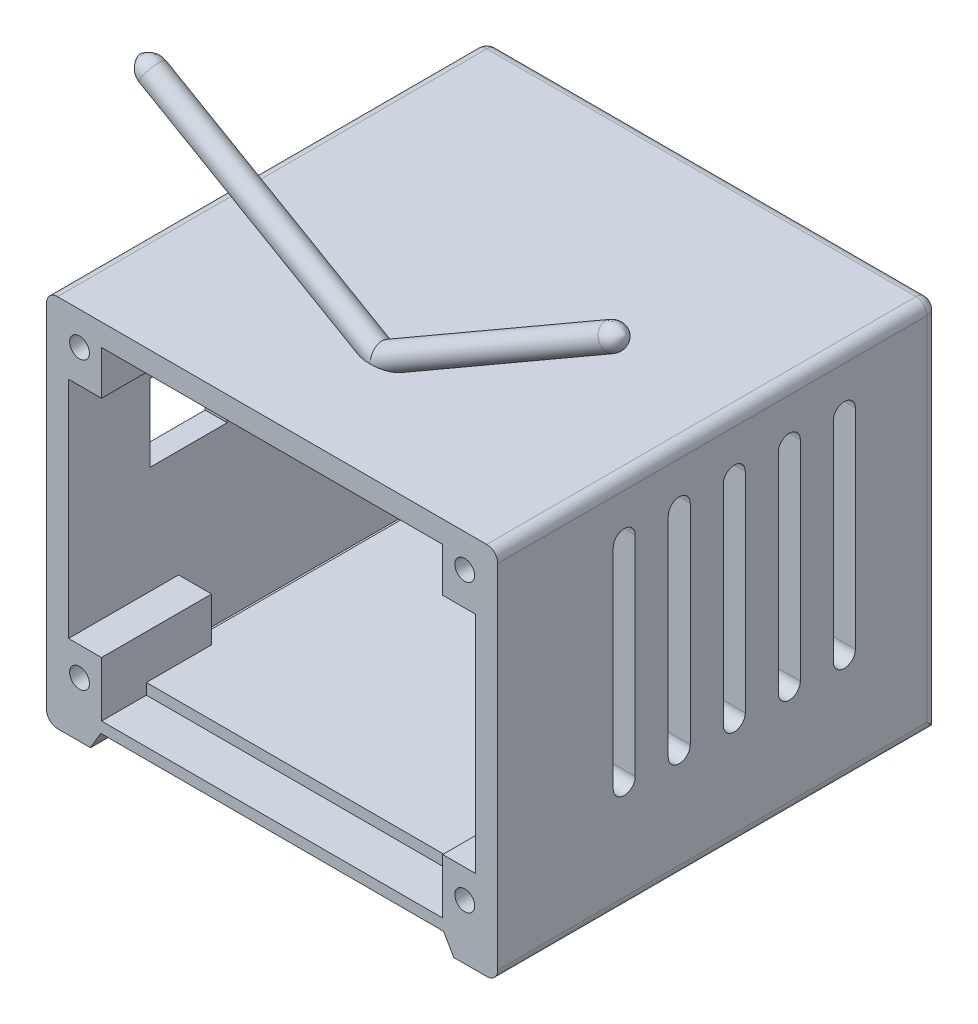
from build123d import *

# Parameters (mm, degrees)
EXTRUDE_1_DEPTH          = 40
SHELL_1_T                = -2
CUT_EXTRUDE_1_REACH      = 63.557
CUT_EXTRUDE_2_REACH      = 63.557
CUT_EXTRUDE_3_DEPTH      = 40
FILLET_1_R               = 1
EXTRUDE_3_DEPTH          = 10
CUT_EXTRUDE_6_DEPTH      = 2
CUT_EXTRUDE_6_DEPTH_BACK = 7
SKETCH_12_R              = 1.4999999999999987
SKETCH_14_R              = 2.5000000000000004
EXTRUDE_4_DEPTH          = 1
CUT_EXTRUDE_7_DEPTH      = 3
CUT_EXTRUDE_7_DEPTH_BACK = 1
SKETCH_12_3_R            = 1.4999999999999987
SKETCH_15_W              = 0.31410256410256565
SKETCH_15_H              = 2.5576923076923075
EXTRUDE_5_DEPTH          = 1
SKETCH_16_R              = 0.9000000000000002
SKETCH_16_R_2            = 0.9000000000000007
CUT_EXTRUDE_8_DEPTH      = 5
CUT_EXTRUDE_9_DEPTH      = 1


with BuildPart() as part:
    # 草图1 → 凸台-拉伸1 (new body)
    with BuildSketch(Plane.XY):
        Polygon((-19.615384615384617, 11.455384615384613), (21.384615384615383, 11.455384615384613), (21.3846153846154, -22.544615384615383), (17.38461538461538, -22.544615384615362), (16.46085495391198, -20.944615384615357), (-14.691624184681219, -20.94461538461539), (-15.615384615384615, -22.544615384615387), (-19.615384615384613, -22.544615384615387), align=None)
    extrude(amount=EXTRUDE_1_DEPTH)

    # 抽壳1
    shell_1_openings = [part.faces().sort_by_distance(p)[0] for p in [
        (0.884615385, -4.925099568, 40),
    ]]
    offset(amount=SHELL_1_T, openings=shell_1_openings, kind=Kind.INTERSECTION)

    # 草图2 → 切除-拉伸1 (cut, up to next)
    with BuildSketch(Plane(origin=(21.38461538461539, 1.091e-14, 0), x_dir=(0, 0, -1), z_dir=(1, 5.1e-16, 0)), mode=Mode.PRIVATE) as cut_extrude_1_sk1:
        with BuildLine():
            Line((-27.506729177901292, 6.455384615384603), (-27.506729177901285, -12.544615384615396))
            ThreePointArc((-27.506729177901285, -12.544615384615396), (-28.506729177901292, -13.5446153846154), (-29.506729177901295, -12.544615384615396))
            Line((-29.506729177901295, -12.544615384615396), (-29.506729177901292, 6.455384615384603))
            ThreePointArc((-29.506729177901292, 6.455384615384603), (-28.506729177901292, 7.455384615384603), (-27.506729177901292, 6.455384615384603))
        make_face()
    cut_extrude_1_tool1 = extrude(cut_extrude_1_sk1.sketch, amount=-CUT_EXTRUDE_1_REACH, mode=Mode.PRIVATE) & part.part
    # 草图2 → 切除-拉伸1 (cut, up to next)
    with BuildSketch(Plane(origin=(21.38461538461539, 1.091e-14, 0), x_dir=(0, 0, -1), z_dir=(1, 5.1e-16, 0)), mode=Mode.PRIVATE) as cut_extrude_1_sk2:
        with BuildLine():
            Line((-22.506729177901292, 6.4553846153846735), (-22.506729177901292, -12.544615384615327))
            ThreePointArc((-22.506729177901292, -12.544615384615327), (-23.506729177901295, -13.544615384615327), (-24.506729177901295, -12.544615384615327))
            Line((-24.506729177901295, -12.544615384615327), (-24.5067291779013, 6.4553846153846735))
            ThreePointArc((-24.5067291779013, 6.4553846153846735), (-23.506729177901295, 7.455384615384677), (-22.506729177901292, 6.4553846153846735))
        make_face()
    cut_extrude_1_tool2 = extrude(cut_extrude_1_sk2.sketch, amount=-CUT_EXTRUDE_1_REACH, mode=Mode.PRIVATE) & part.part
    # 草图2 → 切除-拉伸1 (cut, up to next)
    with BuildSketch(Plane(origin=(21.38461538461539, 1.091e-14, 0), x_dir=(0, 0, -1), z_dir=(1, 5.1e-16, 0)), mode=Mode.PRIVATE) as cut_extrude_1_sk3:
        with BuildLine():
            Line((-17.50672917790129, 6.455384615384743), (-17.50672917790129, -12.544615384615255))
            ThreePointArc((-17.50672917790129, -12.544615384615255), (-18.5067291779013, -13.544615384615259), (-19.506729177901303, -12.544615384615255))
            Line((-19.506729177901303, -12.544615384615255), (-19.5067291779013, 6.455384615384743))
            ThreePointArc((-19.5067291779013, 6.455384615384743), (-18.506729177901295, 7.45538461538475), (-17.50672917790129, 6.455384615384743))
        make_face()
    cut_extrude_1_tool3 = extrude(cut_extrude_1_sk3.sketch, amount=-CUT_EXTRUDE_1_REACH, mode=Mode.PRIVATE) & part.part
    # 草图2 → 切除-拉伸1 (cut, up to next)
    with BuildSketch(Plane(origin=(21.38461538461539, 1.091e-14, 0), x_dir=(0, 0, -1), z_dir=(1, 5.1e-16, 0)), mode=Mode.PRIVATE) as cut_extrude_1_sk4:
        with BuildLine():
            Line((-12.506729177901295, 6.455384615384813), (-12.506729177901295, -12.544615384615186))
            ThreePointArc((-12.506729177901295, -12.544615384615186), (-13.506729177901299, -13.544615384615186), (-14.506729177901299, -12.544615384615186))
            Line((-14.506729177901299, -12.544615384615186), (-14.506729177901294, 6.455384615384813))
            ThreePointArc((-14.506729177901294, 6.455384615384813), (-13.506729177901295, 7.455384615384813), (-12.506729177901295, 6.455384615384813))
        make_face()
    cut_extrude_1_tool4 = extrude(cut_extrude_1_sk4.sketch, amount=-CUT_EXTRUDE_1_REACH, mode=Mode.PRIVATE) & part.part
    # 草图2 → 切除-拉伸1 (cut, up to next)
    with BuildSketch(Plane(origin=(21.38461538461539, 1.091e-14, 0), x_dir=(0, 0, -1), z_dir=(1, 5.1e-16, 0)), mode=Mode.PRIVATE) as cut_extrude_1_sk5:
        with BuildLine():
            Line((-7.506729177901295, 6.455384615384882), (-7.506729177901297, -12.544615384615117))
            ThreePointArc((-7.506729177901297, -12.544615384615117), (-8.506729177901303, -13.544615384615117), (-9.506729177901303, -12.544615384615117))
            Line((-9.506729177901303, -12.544615384615117), (-9.506729177901295, 6.455384615384882))
            ThreePointArc((-9.506729177901295, 6.455384615384882), (-8.506729177901295, 7.455384615384883), (-7.506729177901295, 6.455384615384882))
        make_face()
    cut_extrude_1_tool5 = extrude(cut_extrude_1_sk5.sketch, amount=-CUT_EXTRUDE_1_REACH, mode=Mode.PRIVATE) & part.part
    add(cut_extrude_1_tool1.solids().sort_by_distance((21.384615, -3.044615, 28.506729))[0], mode=Mode.SUBTRACT)
    add(cut_extrude_1_tool2.solids().sort_by_distance((21.384615, -3.044615, 23.506729))[0], mode=Mode.SUBTRACT)
    add(cut_extrude_1_tool3.solids().sort_by_distance((21.384615, -3.044615, 18.506729))[0], mode=Mode.SUBTRACT)
    add(cut_extrude_1_tool4.solids().sort_by_distance((21.384615, -3.044615, 13.506729))[0], mode=Mode.SUBTRACT)
    add(cut_extrude_1_tool5.solids().sort_by_distance((21.384615, -3.044615, 8.506729))[0], mode=Mode.SUBTRACT)

    # 草图3 → 切除-拉伸2 (cut, up to next)
    with BuildSketch(Plane.ZY.offset(19.615384615384617), mode=Mode.PRIVATE) as cut_extrude_2_sk1:
        Polygon((32.58796768047955, 1.8231392903039718), (25.58796768047955, 1.8231392903039707), (25.58796768047955, -5.1768607096960295), (32.58796768047955, -5.1768607096960295), align=None)
    cut_extrude_2_tool1 = extrude(cut_extrude_2_sk1.sketch, amount=-CUT_EXTRUDE_2_REACH, mode=Mode.PRIVATE) & part.part
    add(cut_extrude_2_tool1.solids().sort_by_distance((-19.615385, -1.676861, 29.087968))[0], mode=Mode.SUBTRACT)

    # 草图4 → 切除-拉伸3 (cut)
    with BuildSketch(Plane(origin=(0, 0, 0), x_dir=(-1, 0, 0), z_dir=(0, 0, -1))):
        Polygon((4.6153846153846185, -17.365143113120048), (-7.3846153846153815, -17.365143113120048), (-7.384615384615383, -13.365143113120048), (4.6153846153846185, -13.365143113120048), align=None)
    extrude(amount=-CUT_EXTRUDE_3_DEPTH, mode=Mode.SUBTRACT)

    # 圆角1
    fillet_1_edges = [part.edges().sort_by_distance(p)[0] for p in [
        (0.8846153846153797, -20.944615384615375, 0),
        (-15.153504400032917, -21.744615384615386, 0),
        (-19.615384615384613, -5.544615384615387, 0),
        (-19.615384615384617, 11.455384615384613, 20),
        (21.384615384615383, 11.455384615384613, 20),
        (21.3846153846154, -22.544615384615383, 20),
        (-19.615384615384613, -22.544615384615387, 20),
        (0.8846153846153832, 11.455384615384613, 0),
        (21.384615384615394, -5.544615384615387, 0),
        (16.92273516926368, -21.744615384615358, 0),
    ]]
    fillet(fillet_1_edges, radius=FILLET_1_R)

    # 草图7 → 旋转2 (revolve)
    with BuildSketch(Plane.XY.offset(30), mode=Mode.PRIVATE) as revolve_2_sk:
        with BuildLine():
            Line((0.884615384615383, 12.734359475837627), (-19.416795673872034, 24.45538461538462))
            ThreePointArc((-19.416795673872034, 24.45538461538462), (-20.355916571022963, 24.640605022957534), (-21.212344473206116, 24.21307033757025))
            Line((-21.212344473206116, 24.21307033757025), (-0.22300933533856218, 12.094872045611147))
            Line((-0.22300933533856218, 12.094872045611147), (0.884615384615383, 11.455384615384613))
            Line((0.884615384615383, 11.455384615384613), (3.099864824523301, 11.45538461538461))
            Line((3.099864824523301, 11.45538461538461), (0.884615384615383, 12.734359475837627))
        make_face()
    revolve(revolve_2_sk.sketch.rotate(Axis((-21.212344473206116, 24.21307033757025, 30), (0.8660254037844387, -0.5000000000000001, 0)), 180), axis=Axis((-21.212344473206116, 24.21307033757025, 30), (0.8660254037844387, -0.5000000000000001, 0)))

    # 草图5 → 旋转3 (revolve)
    with BuildSketch(Plane.XY.offset(30), mode=Mode.PRIVATE) as revolve_3_sk:
        with BuildLine():
            Line((21.1860264431028, 24.45538461538462), (0.884615384615383, 12.73435947583762))
            Line((0.884615384615383, 12.73435947583762), (-0.2230093353385754, 12.094872045611117))
            Line((-0.2230093353385754, 12.094872045611117), (-1.330634055292535, 11.45538461538461))
            Line((-1.330634055292535, 11.45538461538461), (0.884615384615383, 11.455384615384613))
            Line((0.884615384615383, 11.455384615384613), (1.9922401045693376, 12.094872045611101))
            Line((1.9922401045693376, 12.094872045611101), (22.981575242436882, 24.213070337570244))
            ThreePointArc((22.981575242436882, 24.213070337570244), (22.12514734025373, 24.64060502295753), (21.1860264431028, 24.45538461538462))
        make_face()
    revolve(revolve_3_sk.sketch.rotate(Axis((1.9922401045693376, 12.094872045611101, 30), (0.8660254037844379, 0.5000000000000013, 0)), 180), axis=Axis((1.9922401045693376, 12.094872045611101, 30), (0.8660254037844379, 0.5000000000000013, 0)))

    # 草图8 → 凸台-拉伸3 (add)
    with BuildSketch(Plane.XY.offset(40)):
        Polygon((-14.615384615384617, 10.455384615384613), (-14.615384615384617, 5.455384615384614), (-19.615384615384617, 5.455384615384613), (-19.615384615384617, 10.455384615384613), (-17.93869022582513, 10.455384615384613), (-15.629289149066627, 10.455384615384613), align=None)
        Polygon((-19.615384615384617, -14.944615384615384), (-14.615384615384617, -14.944615384615384), (-14.615384615384617, -20.94461538461539), (-19.615384615384613, -20.94461538461539), align=None)
        Polygon((21.38461538461547, 10.455384615384574), (21.384615384615483, 5.455384615384618), (16.38461538461548, 5.4553846153846175), (16.38461538461548, 10.455384615384617), (17.39851991829749, 10.455384615384613), (19.707920995055993, 10.455384615384613), align=None)
        Polygon((21.384615384615408, -20.944615384615428), (21.384615384615486, -14.944615384615378), (16.384615384615483, -14.94461538461538), (16.384615384615486, -20.944615384615386), align=None)
    extrude(amount=-EXTRUDE_3_DEPTH)

    # 草图12 → 切除-拉伸6 (cut, two sides: drawn at the far end of the back side and taken through both)
    with BuildSketch(Plane(origin=(1.899e-14, -18.94461538461537, 0), x_dir=(1, 1e-15, 0), z_dir=(-1e-15, 1, 0)).offset(-CUT_EXTRUDE_6_DEPTH_BACK)):
        with Locations(Location((7.384615384615394, -4.000000000000001, 0), (0, 0, 180))):
            Circle(SKETCH_12_R)
    extrude(amount=CUT_EXTRUDE_6_DEPTH + CUT_EXTRUDE_6_DEPTH_BACK, mode=Mode.SUBTRACT)

    # 草图14 → 凸台-拉伸4 (add)
    with BuildSketch(Plane(origin=(1.899e-14, -18.94461538461537, 0), x_dir=(1, 1e-15, 0), z_dir=(-1e-15, 1, 0))):
        with Locations((7.384615384615394, -4)):
            Circle(SKETCH_14_R)
    extrude(amount=EXTRUDE_4_DEPTH)

    # 草图12<3> → 切除-拉伸7 (cut, two sides: drawn at the far end of the back side and taken through both)
    with BuildSketch(Plane(origin=(1.899e-14, -18.94461538461537, 0), x_dir=(1, 1e-15, 0), z_dir=(-1e-15, 1, 0)).offset(-CUT_EXTRUDE_7_DEPTH_BACK)):
        with Locations(Location((7.384615384615394, -4.000000000000001, 0), (0, 0, 180))):
            Circle(SKETCH_12_3_R)
    extrude(amount=CUT_EXTRUDE_7_DEPTH + CUT_EXTRUDE_7_DEPTH_BACK, mode=Mode.SUBTRACT)

    # 草图15 → 凸台-拉伸5 (add)
    # profile 1 of 10: a face of its own
    with BuildSketch(Plane(origin=(0, 0, 0), x_dir=(-1, 0, 0), z_dir=(0, 0, -1))):
        Polygon((-13.235435618454334, -2.4264448842055053), (-12.896793791531257, -2.4264448842055053), (-12.030908374864591, -4.3853791790773), (-11.151701644095361, -2.4264448842055053), (-10.81235869537741, -2.4264448842055053), (-12.382871515890232, -5.926444884205505), (-12.72221446460818, -5.926444884205505), (-12.201280971018436, -4.766088313692684), align=None)
    # profile 2 of 10: a face of its own
    with BuildSketch(Plane(origin=(0, 0, 0), x_dir=(-1, 0, 0), z_dir=(0, 0, -1))):
        with BuildLine():
            Line((-7.805948438967154, -2.4264448842055053), (-7.805948438967154, -4.984137191897813))
            Line((-7.805948438967154, -4.984137191897813), (-8.120051003069717, -4.984137191897813))
            Line((-8.120051003069717, -4.984137191897813), (-8.120051003069717, -4.541729339333711))
            add(Edge.make_bspline(
                [(-8.120051003069717, -4.541729339333711), (-8.155469793695879, -4.581768933291545), (-8.224590008976724, -4.659906704378485), (-8.3400311269482, -4.761988876869233), (-8.462399304850681, -4.84636719840929), (-8.591100625981381, -4.914517114109679), (-8.726018869326001, -4.965709170447037), (-8.866854956602255, -5.002095329572838), (-9.01366633746779, -5.025489164745088), (-9.113918692257794, -5.027825186614118), (-9.164722477428693, -5.029008986769608)],
                knots=[0, 0, 0, 0, 1.074387032113346, 2.0966798030584064, 3.0901592970760006, 4.057316772982397, 5.018401885804054, 5.98515953282395, 6.97896141729081, 8, 8, 8, 8], degree=3))
            add(Edge.make_bspline(
                [(-9.164722477428693, -5.029008986769608), (-9.209890431261229, -5.027782614500456), (-9.298963636149223, -5.025364154084823), (-9.429992713288136, -5.006601850466546), (-9.5560849627408, -4.97647122882447), (-9.677359535402589, -4.934570339332702), (-9.793031680836691, -4.8789895176945155), (-9.904091777509, -4.812448269653099), (-10.009964469528116, -4.7332074395724515), (-10.10903600849197, -4.6426194112195605), (-10.20026800886787, -4.54422442403595), (-10.280329281490056, -4.439278877160821), (-10.347082361344802, -4.328236573268153), (-10.402902442052078, -4.21250341937944), (-10.44589878649281, -4.091188499845408), (-10.475872420750727, -3.964711331905629), (-10.494612867451393, -3.833221458365781), (-10.497030328136344, -3.743681935270172), (-10.498256131274847, -3.6982798201029414)],
                knots=[0, 0, 0, 0, 1.0339198614522676, 2.0389357463115, 3.0240660249270315, 3.9988811309767454, 4.9706952598507455, 5.957263378189181, 6.959025759952125, 7.993208707104535, 9.027059324350772, 10.027763470871653, 11.009749336982424, 11.988697704588022, 12.965288444975128, 13.950418723590651, 14.960734634952502, 16, 16, 16, 16], degree=3))
            add(Edge.make_bspline(
                [(-10.498256131274847, -3.6982798201029414), (-10.497003159889964, -3.653816116533513), (-10.494526103054797, -3.565913773214179), (-10.47607288321453, -3.436635075228321), (-10.445041874555352, -3.3121168144950786), (-10.401494026889464, -3.1927598712713205), (-10.345652071926345, -3.07841982112273), (-10.277723984905489, -2.9690157961077923), (-10.197704860206654, -2.864246398645756), (-10.10545245319027, -2.766575171826981), (-10.00551768302763, -2.6763545575576013), (-9.89860895211226, -2.5979455121151354), (-9.787385670791428, -2.5302286632991144), (-9.670122660269046, -2.476575186992763), (-9.54855555545505, -2.4331660824483046), (-9.421602109707818, -2.4031331143477894), (-9.289790531032246, -2.385435793107782), (-9.200300038967631, -2.382873028956696), (-9.154906772300489, -2.3815730893337106)],
                knots=[0, 0, 0, 0, 1.0203925168901158, 2.0172609598320914, 2.9904654839553175, 3.961182958681917, 4.92805369863115, 5.906110375375646, 6.912531643907274, 7.94865271099346, 8.985773171673054, 9.998621851975404, 10.9876215878708, 11.96926133212434, 12.953316658238332, 13.946091881101239, 14.958173133256869, 16, 16, 16, 16], degree=3))
            add(Edge.make_bspline(
                [(-9.154906772300489, -2.3815730893337106), (-9.102706913237546, -2.3830108408755706), (-9.000345453257122, -2.3858302037925556), (-8.850617443990297, -2.409292931111536), (-8.708972966086742, -2.4489313982663816), (-8.574318614056665, -2.502848896289889), (-8.447137927961837, -2.5744976253718046), (-8.328634943645893, -2.664877586395442), (-8.217569460338083, -2.773418773365568), (-8.153189168678859, -2.856789217834797), (-8.120051003069717, -2.899702095743967)],
                knots=[0, 0, 0, 0, 1.0388971337659028, 2.037228247178309, 3.0081164335497066, 3.962042014540862, 4.918381754395657, 5.904844433346657, 6.921570400578856, 8, 8, 8, 8], degree=3))
            Line((-8.120051003069717, -2.899702095743967), (-8.120051003069717, -2.4264448842055053))
            Line((-8.120051003069717, -2.4264448842055053), (-7.805948438967154, -2.4264448842055053))
        make_face()
        with BuildLine():
            add(Edge.make_bspline(
                [(-9.150700041531257, -2.6956756534362745), (-9.196614379403313, -2.6973092911668264), (-9.287241979373212, -2.700533832205679), (-9.420285981435638, -2.725707327390246), (-9.547599395523676, -2.767591921754), (-9.668545469792242, -2.824873822922362), (-9.781213686414842, -2.8969025595394164), (-9.881907357244167, -2.9840239428312483), (-9.971450058600102, -3.0838609569859003), (-10.046758322832867, -3.195963067376079), (-10.10814881975255, -3.316141158444706), (-10.15131585168929, -3.44176559654578), (-10.179785099098446, -3.5705705741024647), (-10.182693619659915, -3.657933259880212), (-10.184153567172283, -3.7017854290773005)],
                knots=[0, 0, 0, 0, 1.031046208941199, 2.035121221496928, 3.0297061784224573, 4.034933723484602, 5.0340542524988665, 6.024430879729069, 7.0172957721224565, 8.038157696469613, 9.050218396665436, 10.039898859951926, 11.016116708505663, 12, 12, 12, 12], degree=3))
            add(Edge.make_bspline(
                [(-10.184153567172283, -3.7017854290773005), (-10.182288673862512, -3.745375536261301), (-10.178566196995003, -3.832384892128803), (-10.151815502597021, -3.9613654688971662), (-10.10693562916347, -4.087019510958487), (-10.045693566435428, -4.208280504478178), (-9.969006941706722, -4.320864604841867), (-9.880118289154492, -4.422604727403435), (-9.778168007841625, -4.510094315676241), (-9.665240500767542, -4.583331889281732), (-9.544632530367194, -4.642494410177168), (-9.417798598894336, -4.683660049684139), (-9.287122960737843, -4.710237830304314), (-9.198270626885913, -4.71334230714137), (-9.153504528710744, -4.7149064226670445)],
                knots=[0, 0, 0, 0, 0.9790721871862018, 1.954306742015218, 2.9458042713069506, 3.9696856698961316, 4.997920485315419, 5.99871843792759, 6.996577871940261, 8.005894224745894, 9.015743151514975, 10.005417472291388, 10.995077862527774, 12, 12, 12, 12], degree=3))
            add(Edge.make_bspline(
                [(-9.153504528710744, -4.7149064226670445), (-9.108058025948575, -4.7132464587412395), (-9.017669439427124, -4.709944955131264), (-8.88423073154711, -4.684663689838033), (-8.754735768749244, -4.642894891487973), (-8.630948540370891, -4.584995764753988), (-8.515632409223045, -4.513238408856912), (-8.412134531606602, -4.429231317826028), (-8.324618563233136, -4.331528133704024), (-8.250425953654908, -4.224151680659018), (-8.19225053695629, -4.10643968419815), (-8.149874477759226, -3.9811054934522367), (-8.12482057198291, -3.848144745307199), (-8.121662842340355, -3.7572808183485793), (-8.120051003069717, -3.710900012410634)],
                knots=[0, 0, 0, 0, 1.0176286604259368, 2.023962475198101, 3.030623092473401, 4.0588762735709425, 5.0772319367178715, 6.066672612691476, 7.0341078718686365, 8.005628643964329, 8.981990163666405, 9.965428785099354, 10.961468474412163, 12, 12, 12, 12], degree=3))
            add(Edge.make_bspline(
                [(-8.120051003069717, -3.710900012410634), (-8.121010659441307, -3.675562181902877), (-8.122899566870865, -3.6060061485489996), (-8.137330136401513, -3.5038786309769687), (-8.160285062813433, -3.406144904956649), (-8.192631232829907, -3.3127022158980495), (-8.235122517245463, -3.2240672004988067), (-8.286370283131863, -3.1396034402884907), (-8.347275732865452, -3.0597502288988103), (-8.416858428965424, -2.9856071579203385), (-8.493023631510889, -2.9179806956611163), (-8.57361817214297, -2.8576164549493543), (-8.659596919100402, -2.8080276822094974), (-8.749513956018152, -2.7669864107118554), (-8.843525290480203, -2.734327260814253), (-8.942395910298753, -2.712539567046185), (-9.045074897225808, -2.6975792460107866), (-9.115120952622123, -2.696316865241481), (-9.150700041531257, -2.6956756534362745)],
                knots=[0, 0, 0, 0, 1.0501407948110415, 2.0670094089140636, 3.0594989297950232, 4.030605086098515, 5.000119590184805, 5.9759109404031765, 6.962425594464801, 7.979863590506388, 8.99352347194609, 9.986985068986487, 10.967611495443121, 11.937549036896854, 12.921786183164564, 13.919465290515022, 14.943216302638504, 16, 16, 16, 16], degree=3))
        make_face(mode=Mode.SUBTRACT)
    # profile 3 of 10: a face of its own
    with BuildSketch(Plane(origin=(0, 0, 0), x_dir=(-1, 0, 0), z_dir=(0, 0, -1))):
        with BuildLine():
            Line((-7.087999721018436, -2.4264448842055053), (-6.773897156915872, -2.4264448842055053))
            Line((-6.773897156915872, -2.4264448842055053), (-6.773897156915872, -2.8877830252311463))
            add(Edge.make_bspline(
                [(-6.773897156915872, -2.8877830252311463), (-6.740359521783757, -2.845940302393521), (-6.675278570737192, -2.76474303890362), (-6.56689423746178, -2.6580224643435364), (-6.452350337139167, -2.570077239298755), (-6.332348333652007, -2.499973445354434), (-6.206725323552079, -2.447126819205771), (-6.076247053588984, -2.4089608881201), (-5.940132347501182, -2.3860760595804797), (-5.847567910627642, -2.3830858292809554), (-5.800740105633821, -2.3815730893337106)],
                knots=[0, 0, 0, 0, 1.1278077301501674, 2.1885502477053578, 3.191906510434029, 4.1594382511394565, 5.104880172197961, 6.052711205924762, 7.014878035284857, 8, 8, 8, 8], degree=3))
            add(Edge.make_bspline(
                [(-5.800740105633821, -2.3815730893337106), (-5.753409471517272, -2.3833182847749055), (-5.660772003753461, -2.3867340532183854), (-5.525893942371404, -2.413750744329432), (-5.399920548684625, -2.4598959994540848), (-5.283300992896536, -2.5231080698571318), (-5.1781737795338945, -2.6017145432609348), (-5.085848928057726, -2.6932923250200895), (-5.009485680680142, -2.7986284082556994), (-4.95828831768043, -2.8963515644923), (-4.924562669989443, -2.9830403587650967), (-4.903330332475621, -3.0572871088639455), (-4.885299351016248, -3.1400052600330204), (-4.86966760299855, -3.230944849087416), (-4.859090491131115, -3.330743039339775), (-4.850748199599836, -3.4389907313926975), (-4.844769505311535, -3.555652861888278), (-4.844532298324787, -3.63633948929816), (-4.844409977428692, -3.6779472880516595)],
                knots=[0, 0, 0, 0, 1.235846777863659, 2.418850247462125, 3.5758077408063955, 4.728682307181917, 5.871620073916632, 6.994088407782181, 8.112697850292307, 9.256955736378849, 9.86581671514485, 10.540099791640463, 11.271859617830467, 12.0768498384824, 12.949306005097048, 13.892391287565136, 14.9131661345487, 15.999999999999998, 15.999999999999998, 15.999999999999998, 15.999999999999998], degree=3))
            Line((-4.844409977428692, -3.6779472880516595), (-4.844409977428692, -4.984137191897813))
            Line((-4.844409977428692, -4.984137191897813), (-5.158512541531256, -4.984137191897813))
            Line((-5.158512541531256, -4.984137191897813), (-5.158512541531256, -3.781012191897813))
            add(Edge.make_bspline(
                [(-5.158512541531256, -3.781012191897813), (-5.158705749550203, -3.746189746969055), (-5.15907532360869, -3.679580336195088), (-5.16024097029323, -3.5842113130047464), (-5.163050776896193, -3.4977247346019666), (-5.166999089812236, -3.420327367196544), (-5.17277812034149, -3.352093530633195), (-5.1788007516914885, -3.2928842538946914), (-5.186165728488431, -3.242774711461877), (-5.192728641625594, -3.212609629078747), (-5.195671996659462, -3.1990811021542234)],
                knots=[0, 0, 0, 0, 1.430800155289277, 2.736877191538394, 3.918605306947136, 4.986035425796514, 5.920637408686338, 6.731861384559884, 7.43126137747252, 8, 8, 8, 8], degree=3))
            add(Edge.make_bspline(
                [(-5.195671996659462, -3.1990811021542234), (-5.206297528165786, -3.1593699172065746), (-5.226748388840487, -3.0829381725820033), (-5.277282371965628, -2.9792638199605563), (-5.341096552752997, -2.8910656321312573), (-5.418994402118166, -2.8188889105068653), (-5.510223477758536, -2.7627180738018553), (-5.614530620526371, -2.7237441190747966), (-5.7309092611986925, -2.699367849875889), (-5.812763643872175, -2.6969407178605627), (-5.855427605633821, -2.6956756534362745)],
                knots=[0, 0, 0, 0, 1.0841562269648397, 2.0866653055494275, 3.027808232996021, 3.945421171797415, 4.874247719431505, 5.8398483028531665, 6.87409047144053, 7.999999999999999, 7.999999999999999, 7.999999999999999, 7.999999999999999], degree=3))
            add(Edge.make_bspline(
                [(-5.855427605633821, -2.6956756534362745), (-5.88069528923869, -2.6961516580998146), (-5.930699382240452, -2.697093659030218), (-6.0048493541466, -2.706544957053207), (-6.076773527324559, -2.7220034126515658), (-6.147193736319338, -2.742872050150713), (-6.214701530054379, -2.771534319373402), (-6.281465821234562, -2.8040636895983075), (-6.344972585364391, -2.8446119015836384), (-6.40657598249287, -2.8898025230233984), (-6.463888790146041, -2.939881730220988), (-6.517217128556697, -2.9927262403738766), (-6.564755148807799, -3.049001844169962), (-6.607823824091489, -3.107801791699036), (-6.645002087469065, -3.1699336296961356), (-6.677455175531377, -3.2347979361749397), (-6.704990870323113, -3.3024800849988045), (-6.71867356279296, -3.3494551462295616), (-6.725519753069718, -3.3729593072824287)],
                knots=[0, 0, 0, 0, 1.0237777570634656, 2.0260297294316345, 3.023749951703791, 4.003683103366368, 4.997618607397139, 5.993177895327016, 7.010360494051259, 8.046726601717923, 9.087585522244343, 10.092341339987039, 11.086953742807342, 12.07036054899726, 13.043493632276721, 14.017870807697452, 15.008233676703249, 16, 16, 16, 16], degree=3))
            add(Edge.make_bspline(
                [(-6.725519753069718, -3.3729593072824287), (-6.729459401645408, -3.390214510336322), (-6.738035810506367, -3.4277781847417534), (-6.747298990365227, -3.489422604126334), (-6.755706565766903, -3.560732579118492), (-6.762743524385476, -3.6416248961743296), (-6.7670489408560535, -3.732382771291873), (-6.771743337629707, -3.832618609095864), (-6.773452398696094, -3.942732097451947), (-6.77374475271364, -4.019393790176713), (-6.773897156915872, -4.059357544461916)],
                knots=[0, 0, 0, 0, 0.6159636377364609, 1.3409206174653838, 2.168419149073875, 3.115676020576591, 4.166742419724606, 5.331190068864586, 6.60874890012252, 8, 8, 8, 8], degree=3))
            Line((-6.773897156915872, -4.059357544461916), (-6.773897156915872, -4.984137191897813))
            Line((-6.773897156915872, -4.984137191897813), (-7.087999721018436, -4.984137191897813))
            Line((-7.087999721018436, -4.984137191897813), (-7.087999721018436, -2.4264448842055053))
        make_face()
    # profile 4 of 10: a face of its own
    with BuildSketch(Plane(origin=(0, 0, 0), x_dir=(-1, 0, 0), z_dir=(0, 0, -1))):
        with BuildLine():
            Line((-1.8828715158902312, -2.4264448842055053), (-1.568768951787666, -2.4264448842055053))
            Line((-1.568768951787666, -2.4264448842055053), (-1.568768951787666, -4.456192480359352))
            add(Edge.make_bspline(
                [(-1.568768951787666, -4.456192480359352), (-1.5690459943585582, -4.499430074966175), (-1.5695807532546657, -4.58288904767143), (-1.5734317245093088, -4.703567327284336), (-1.581552401729688, -4.815033412816229), (-1.5907610830832373, -4.917795671405454), (-1.604007799402787, -5.011377781465432), (-1.6201841666411683, -5.0960589861394165), (-1.6384198457932613, -5.171920548507031), (-1.654440063247575, -5.21864538953456), (-1.6620181505056162, -5.24074776882089)],
                knots=[0, 0, 0, 0, 1.3075620387980986, 2.5239097017033645, 3.650326591493328, 4.686913196598194, 5.64342948645402, 6.506965703859498, 7.293745905280799, 8, 8, 8, 8], degree=3))
            add(Edge.make_bspline(
                [(-1.6620181505056162, -5.24074776882089), (-1.6732073892421424, -5.2694776904122795), (-1.6952513156858415, -5.326078527449244), (-1.7365369491447793, -5.406312848242904), (-1.7827708527635944, -5.481859238089155), (-1.8355776033988707, -5.55229668939379), (-1.894718407430644, -5.617271601756241), (-1.9587998995851588, -5.678195601035965), (-2.029070091006686, -5.733779768421211), (-2.1054888032126584, -5.7830650658780245), (-2.1862944364135792, -5.827452120031471), (-2.271440538480255, -5.865898687215075), (-2.36044697684393, -5.89938553083775), (-2.4541498684428573, -5.9244683265674905), (-2.5510801029109063, -5.946203047134418), (-2.652377533991344, -5.960347732928743), (-2.757450330796546, -5.969974791055728), (-2.828895710876923, -5.9708650240349135), (-2.8651431505056153, -5.9713166790773)],
                knots=[0, 0, 0, 0, 0.981931300775359, 1.934503488284449, 2.8707786400004536, 3.8017069990365107, 4.735015491989949, 5.66749162913369, 6.61659306551481, 7.585388520850982, 8.561939025284293, 9.551802639395596, 10.560317336748897, 11.58843994375192, 12.640189603608606, 13.723962949351153, 14.845264515448761, 15.999999999999998, 15.999999999999998, 15.999999999999998, 15.999999999999998], degree=3))
            add(Edge.make_bspline(
                [(-2.8651431505056153, -5.9713166790773), (-2.918027885107367, -5.970460193266641), (-3.0213259803374117, -5.968787246366198), (-3.171930973022059, -5.949296331274811), (-3.3149656929481184, -5.921741958201443), (-3.4485401496481694, -5.880036530569102), (-3.5718102465188086, -5.8289995408380895), (-3.6839341220489614, -5.770404587883629), (-3.7839052295667703, -5.703215279082245), (-3.8740289025698447, -5.626714678165766), (-3.9553704927059035, -5.535750996528387), (-4.03189778268643, -5.4285521524036335), (-4.105558724544379, -5.303485263252451), (-4.148727362412117, -5.211692550037959), (-4.171333054351769, -5.1636243713849925)],
                knots=[0, 0, 0, 0, 1.1578970852294168, 2.2616840999076997, 3.322078979505765, 4.345638746057099, 5.321241054785491, 6.241986251983472, 7.112515962828019, 7.955008012233809, 8.825025602432447, 9.778571639992997, 10.836726668879825, 12, 12, 12, 12], degree=3))
            Line((-4.171333054351769, -5.1636243713849925), (-3.8572304902492056, -5.1636243713849925))
            add(Edge.make_bspline(
                [(-3.8572304902492056, -5.1636243713849925), (-3.8319682809437823, -5.203730247157399), (-3.7825837725399984, -5.282132295655128), (-3.6902352915731726, -5.383645451589948), (-3.5890289652257574, -5.470398816277393), (-3.4755492820413068, -5.5403095903421065), (-3.349324066633263, -5.593019381743825), (-3.210277380463721, -5.630594678179804), (-3.057277758728826, -5.653090945036156), (-2.950759544545779, -5.655802239176527), (-2.895291387685102, -5.657214114974736)],
                knots=[0, 0, 0, 0, 0.9977318936184523, 1.9504429913240786, 2.8804922725155517, 3.8008959972672502, 4.748200782495247, 5.754801363074869, 6.830838170434118, 8, 8, 8, 8], degree=3))
            add(Edge.make_bspline(
                [(-2.895291387685102, -5.657214114974736), (-2.840524497341206, -5.655783966179675), (-2.7349394146880828, -5.653026782454537), (-2.583108245642724, -5.630584638281861), (-2.444513307574805, -5.593011204520142), (-2.3199531069477866, -5.540402818273996), (-2.210897338410455, -5.47595241173936), (-2.116885347125907, -5.403952337329566), (-2.040740670983281, -5.3227713343149885), (-1.9895277043134556, -5.247989528224263), (-1.957693086714625, -5.181365398527337), (-1.9374208499489955, -5.124012802569758), (-1.9209468804946654, -5.059159924907329), (-1.9071670429590104, -4.987024188684764), (-1.895796129587429, -4.907502531617587), (-1.888593247239973, -4.820413128242737), (-1.8833874356677014, -4.72595390592085), (-1.883047465819054, -4.660460767711191), (-1.8828715158902312, -4.626565076513198)],
                knots=[0, 0, 0, 0, 1.5707407652431116, 3.028230971001376, 4.391408896288629, 5.680370740507808, 6.89472739268695, 8.017376726172056, 9.065722032601572, 10.075533814852792, 10.603371121805758, 11.180248986105822, 11.817768598223395, 12.5212996492551, 13.286540595986038, 14.121245857124437, 15.027658896722862, 16, 16, 16, 16], degree=3))
            Line((-1.8828715158902312, -4.626565076513198), (-1.8828715158902312, -4.494053057282429))
            add(Edge.make_bspline(
                [(-1.8828715158902312, -4.494053057282429), (-1.9147526332927356, -4.5319948594395845), (-1.9779540890167069, -4.607211079086103), (-2.087101416149597, -4.705772715779219), (-2.2063183317794985, -4.790658846080607), (-2.335401874181806, -4.860277480593748), (-2.4711901163405674, -4.915958905203036), (-2.6122123467579654, -4.954901866105828), (-2.757204401959116, -4.980061765996175), (-2.855456551783801, -4.982769082232104), (-2.905107092813308, -4.984137191897813)],
                knots=[0, 0, 0, 0, 1.012485704116201, 2.0071620951035833, 2.997754122520352, 3.998611388747787, 4.999708251462927, 5.992315797909911, 6.985440959530821, 8, 8, 8, 8], degree=3))
            add(Edge.make_bspline(
                [(-2.905107092813308, -4.984137191897813), (-2.934343362234834, -4.983622165427354), (-2.992469919790732, -4.982598207296913), (-3.078824667023015, -4.973639429871798), (-3.163905105351408, -4.960640687577591), (-3.247512808978367, -4.941559248593861), (-3.329768422045287, -4.917067522055073), (-3.4105360141666288, -4.886450783305573), (-3.4904695407334216, -4.851835665038858), (-3.568116038595144, -4.811062861599921), (-3.642702169329583, -4.765700554739934), (-3.7136653544648883, -4.716561664029821), (-3.7806338935523858, -4.663903375788413), (-3.8429703830019206, -4.607206435992261), (-3.900593054450838, -4.5465529032299425), (-3.9542769225055414, -4.482589350197334), (-4.003134269572521, -4.41442260885183), (-4.048167658813042, -4.3432956513186625), (-4.087225209186181, -4.268734727507122), (-4.121509581011424, -4.192356632079385), (-4.151318986052179, -4.114324677594005), (-4.175084387788719, -4.034377614939489), (-4.193235501058467, -3.952565846073284), (-4.206745728047511, -3.869023397201409), (-4.2144086597032775, -3.7834930095713553), (-4.215603583747574, -3.7258716603766713), (-4.216204849223564, -3.696877576513198)],
                knots=[0, 0, 0, 0, 1.0287542167485988, 2.0453341816135553, 3.0528548194496876, 4.056607502606393, 5.0611687943930255, 6.071104265450905, 7.095078842401183, 8.125279047134654, 9.155117945212487, 10.16595749143834, 11.161587969490807, 12.151493252204713, 13.128948131078733, 14.104219989436098, 15.088194871141429, 16.07871515046623, 17.064853786945807, 18.04789988724517, 19.024142579604103, 20.002704429250606, 20.9805745690138, 21.971845992707184, 22.979467364139524, 24, 24, 24, 24], degree=3))
            add(Edge.make_bspline(
                [(-4.216204849223564, -3.696877576513198), (-4.215685682948023, -3.66787448051408), (-4.214649361203266, -3.6099806217154966), (-4.205698381851857, -3.524101236328032), (-4.192930192427781, -3.439371801086143), (-4.172722423431889, -3.3566656593940936), (-4.148399900921005, -3.275040907630725), (-4.118276328363732, -3.195100451219237), (-4.082057569026794, -3.116819942112027), (-4.041047819350383, -3.040141410666611), (-3.9949637266988693, -2.9660937957321565), (-3.944431245891814, -2.895767149827478), (-3.889389371632035, -2.8296789779015934), (-3.830597456011776, -2.7671625560332087), (-3.7673376389734696, -2.708821062816731), (-3.6996426466281966, -2.654796097933238), (-3.628179766381902, -2.6041820716637156), (-3.55272751638599, -2.5580707345026816), (-3.474450127869279, -2.517288487982722), (-3.3953363100763982, -2.480075891058052), (-3.3143380750556184, -2.45054177152792), (-3.2329655356316707, -2.4245186724924292), (-3.1497856208686685, -2.40608347727258), (-3.065818227246206, -2.3918612353548245), (-2.980775889490937, -2.3831965143295326), (-2.923822994443381, -2.3821149293468578), (-2.895291387685102, -2.3815730893337106)],
                knots=[0, 0, 0, 0, 1.0088188479322986, 2.013730394069599, 3.0016544267669807, 3.987803272875369, 4.97304654889751, 5.96377756935008, 6.957074693587044, 7.972068340898089, 8.98742021169413, 9.989399530949012, 10.98263008700414, 11.97775609121338, 12.973280677282746, 13.973972380688602, 14.98919400302398, 16.01838722210486, 17.047741039332788, 18.059210845676787, 19.057554164251336, 20.045176975080302, 21.02948026139245, 22.01870852894763, 23.00743537131176, 23.999999999999996, 23.999999999999996, 23.999999999999996, 23.999999999999996], degree=3))
            add(Edge.make_bspline(
                [(-2.895291387685102, -2.3815730893337106), (-2.8482404487056394, -2.3829297626158494), (-2.755329301385313, -2.3856087754882047), (-2.618598298956831, -2.406629920871406), (-2.486656058979871, -2.440143934223054), (-2.3587580433028985, -2.488159564733235), (-2.2338623923016363, -2.5537096030682642), (-2.112380736991617, -2.640052551078545), (-1.9939616028166982, -2.747962890810509), (-1.9208837722690122, -2.8307157551777187), (-1.8828715158902312, -2.8737605893337106)],
                knots=[0, 0, 0, 0, 0.9672886299896992, 1.9100978291098045, 2.838038872678902, 3.7628751956017426, 4.713152790342971, 5.7306312386907585, 6.819562286860808, 8, 8, 8, 8], degree=3))
            Line((-1.8828715158902312, -2.8737605893337106), (-1.8828715158902312, -2.4264448842055053))
        make_face()
        with BuildLine():
            add(Edge.make_bspline(
                [(-2.8700510030697184, -2.6956756534362745), (-2.915981706954176, -2.697236718938444), (-3.0069147613412768, -2.700327297619052), (-3.140203103826893, -2.726712010772181), (-3.2688800372902587, -2.768057910776773), (-3.390485465475147, -2.8272005262117967), (-3.504392575381316, -2.8992947641576756), (-3.6054673958393737, -2.986635051748626), (-3.693872311932237, -3.086381248626852), (-3.7686552502265283, -3.1976314956316716), (-3.8281866167013012, -3.3176537711012206), (-3.870330036166611, -3.444164505235377), (-3.897580059446108, -3.575119498033666), (-3.9005877114895253, -3.664492101211782), (-3.9021022851210008, -3.70949776882089)],
                knots=[0, 0, 0, 0, 1.0262267910321865, 2.031711441592071, 3.026614838558192, 4.041077450230255, 5.047145931074409, 6.032893242166739, 7.017642608593807, 8.019221815487382, 9.021877557325888, 10.003543541346353, 10.9946375893835, 12, 12, 12, 12], degree=3))
            add(Edge.make_bspline(
                [(-3.9021022851210008, -3.70949776882089), (-3.9013765282886377, -3.743431041363467), (-3.899949176832074, -3.810167865365426), (-3.8862255990812797, -3.9081057600824485), (-3.8640446339534456, -4.001386073716734), (-3.8326074276451707, -4.090014448174204), (-3.793654732759051, -4.174499243054438), (-3.7446623617895476, -4.25425847780384), (-3.687011390094746, -4.329363183877595), (-3.62115305216811, -4.399257865654712), (-3.5485766702988846, -4.462918834073643), (-3.4698574709889978, -4.5188568747131725), (-3.3851022212663966, -4.5646075956358985), (-3.2963954110626044, -4.604148433251638), (-3.2015846550810285, -4.633027501186095), (-3.1020355690156816, -4.655066280206585), (-2.99704387252935, -4.6676750377503184), (-2.9254721332552034, -4.669237835547019), (-2.8889812915312563, -4.670034627795249)],
                knots=[0, 0, 0, 0, 1.0397287069054841, 2.04484231915657, 3.024901383541774, 3.9743143579989537, 4.923051295276128, 5.871625911937809, 6.837440707616104, 7.820715446261513, 8.810779094496104, 9.792721782759816, 10.773906224103486, 11.758876062948012, 12.764959492789215, 13.806266761054447, 14.881525400685067, 15.999999999999998, 15.999999999999998, 15.999999999999998, 15.999999999999998], degree=3))
            add(Edge.make_bspline(
                [(-2.8889812915312563, -4.670034627795249), (-2.852017533335601, -4.66926701875528), (-2.779735295874345, -4.667765967411671), (-2.6741643594814213, -4.6548624688558435), (-2.5741316191101022, -4.634040492569241), (-2.4797287967479824, -4.604477467241766), (-2.3905994556841286, -4.566755716615729), (-2.307744841078928, -4.519019099105284), (-2.2293883930110754, -4.46465466706169), (-2.15803198342707, -4.4012426528406765), (-2.093507817904755, -4.331357657850391), (-2.037277051012488, -4.255312762835634), (-1.9893626019878807, -4.174252243788016), (-1.9496849321427363, -4.08818523811325), (-1.9193937279754651, -3.9964428850485025), (-1.8990748229690415, -3.8992545292757765), (-1.8848680778075528, -3.797085790414799), (-1.8835471531143126, -3.727077174238178), (-1.8828715158902312, -3.6912686021542234)],
                knots=[0, 0, 0, 0, 1.121943987513012, 2.1939495787843493, 3.2237939372261635, 4.220241906670012, 5.19296152058767, 6.155822191351426, 7.118473669636284, 8.083710713867418, 9.047903919743868, 10.001595906330941, 10.949595423105514, 11.902125207759427, 12.873731292036911, 13.875822620348048, 14.91350860833362, 16, 16, 16, 16], degree=3))
            add(Edge.make_bspline(
                [(-1.8828715158902312, -3.6912686021542234), (-1.8842110840596524, -3.6446507481949992), (-1.8868281295349116, -3.553575843195586), (-1.9115252871988484, -3.4208690752059807), (-1.9513454973849134, -3.2961004014373603), (-2.0071922496657266, -3.1796644255645794), (-2.0771742583470254, -3.072794875861942), (-2.1614651071704687, -2.9774710313924273), (-2.258611137786732, -2.893570174819516), (-2.368333237964156, -2.82367198130207), (-2.4863806830952226, -2.7672065468654905), (-2.6099018791855504, -2.724844774736048), (-2.7387134430840145, -2.7008504597046863), (-2.8260198526411666, -2.6974105164356166), (-2.8700510030697184, -2.6956756534362745)],
                knots=[0, 0, 0, 0, 1.0709135186501777, 2.0921886936057317, 3.0913573050333865, 4.074328407875251, 5.051968681775203, 6.0189487072868815, 6.990501119970051, 7.993591900005907, 9.00058957225924, 9.992915276931422, 10.987769055988622, 12, 12, 12, 12], degree=3))
        make_face(mode=Mode.SUBTRACT)
    # profile 5 of 10: a face of its own
    with BuildSketch(Plane(origin=(0, 0, 0), x_dir=(-1, 0, 0), z_dir=(0, 0, -1))):
        Polygon((-1.1200510030697184, -2.4264448842055053), (-0.781409176146641, -2.4264448842055053), (0.08447624052002577, -4.3853791790773), (0.9636829712892561, -2.4264448842055053), (1.3030259200072052, -2.4264448842055053), (-0.2674869005056153, -5.926444884205505), (-0.6068298492235644, -5.926444884205505), (-0.0858963556338195, -4.766088313692684), align=None)
    # profile 6 of 10: a face of its own
    with BuildSketch(Plane(origin=(0, 0, 0), x_dir=(-1, 0, 0), z_dir=(0, 0, -1))):
        with BuildLine():
            add(Edge.make_bspline(
                [(1.8176493174431023, -1.3495218072824282), (1.83714063323124, -1.3504259596781616), (1.8753083730737168, -1.3521964637217776), (1.9305016407499906, -1.3673579408003975), (1.9807586528253212, -1.3930576262448962), (2.025336385715183, -1.4275373071454844), (2.0635882723961507, -1.4680867506047246), (2.0903689827715595, -1.5153477188999698), (2.107581378886832, -1.566406357688829), (2.1096599341643847, -1.6020214468699108), (2.110718227699513, -1.6201548201029412)],
                knots=[0, 0, 0, 0, 1.0551941146486297, 2.06627273853581, 3.074728998232828, 4.095836921005749, 5.109056067369193, 6.073838105316696, 7.019297344281637, 7.999999999999999, 7.999999999999999, 7.999999999999999, 7.999999999999999], degree=3))
            add(Edge.make_bspline(
                [(2.110718227699513, -1.6201548201029412), (2.1096360678746664, -1.6378174732661501), (2.1074967659692887, -1.6727344482808315), (2.090382277717934, -1.7229079203332418), (2.0633600398754193, -1.7695122038166082), (2.0253609142492914, -1.8099829140288661), (1.9807521532473953, -1.8444435340193792), (1.9305033673972978, -1.8701482729244066), (1.8753079188827642, -1.8853084102901254), (1.837140479694572, -1.8870790990289719), (1.8176493174431023, -1.887983345743967)],
                knots=[0, 0, 0, 0, 0.9612970799407291, 1.900370562215019, 2.859976407418845, 3.8793369797221318, 4.90663414468101, 5.921202961029501, 6.938410036506101, 8, 8, 8, 8], degree=3))
            add(Edge.make_bspline(
                [(1.8176493174431023, -1.887983345743967), (1.7983810422763706, -1.8871136255222836), (1.7608778621147598, -1.8854208287419933), (1.7065110197725202, -1.869850811005663), (1.6566825303792028, -1.8444347379051629), (1.6120178577208835, -1.8102085528099463), (1.57478766458875, -1.7692636555802779), (1.547689339192184, -1.7229363617231561), (1.530614377306563, -1.672727207105171), (1.5284697486918797, -1.6378150407960357), (1.5273848943661799, -1.6201548201029412)],
                knots=[0, 0, 0, 0, 1.0549340136186618, 2.0532912276269233, 3.073705703539995, 4.106921865220675, 5.123545214603137, 6.088680038223066, 7.033164197225286, 8, 8, 8, 8], degree=3))
            add(Edge.make_bspline(
                [(1.5273848943661799, -1.6201548201029412), (1.5284459809830242, -1.6020239705002162), (1.5305300220493012, -1.5664138378882861), (1.5477021381877518, -1.5153188049726016), (1.5745619459496356, -1.4683373031694467), (1.6120425094831408, -1.4273118037434964), (1.6566759697535467, -1.3930663689744063), (1.706512714920089, -1.367655387472235), (1.7608774142986778, -1.3520840481019596), (1.7983808902872516, -1.3503914337675802), (1.8176493174431023, -1.3495218072824282)],
                knots=[0, 0, 0, 0, 0.9863189498223652, 1.9371926506717638, 2.907499808429821, 3.917963146730997, 4.944918756744063, 5.9591502500579745, 6.95145813271347, 7.999999999999999, 7.999999999999999, 7.999999999999999, 7.999999999999999], degree=3))
        make_face()
    # profile 7 of 10: a face of its own
    with BuildSketch(Plane(origin=(0, 0, 0), x_dir=(-1, 0, 0), z_dir=(0, 0, -1))):
        with Locations((1.8190515610328464, -3.705291038051659)):
            Rectangle(SKETCH_15_W, SKETCH_15_H)
    # profile 8 of 10: a face of its own
    with BuildSketch(Plane(origin=(0, 0, 0), x_dir=(-1, 0, 0), z_dir=(0, 0, -1))):
        with BuildLine():
            Line((3.2773848943661794, -5.073880781641403), (3.026383291802076, -4.8993014547183265))
            Line((3.026383291802076, -4.8993014547183265), (3.99954034308413, -3.476725332923454))
            add(Edge.make_bspline(
                [(3.99954034308413, -3.476725332923454), (3.9374496074840404, -3.4843183962461466), (3.815189487347296, -3.4992695612640237), (3.6920523852756473, -3.5020162159825485), (3.631451400776437, -3.5033679611285824)],
                knots=[0, 0, 0, 0, 1.015715272169579, 2, 2, 2, 2], degree=3))
            add(Edge.make_bspline(
                [(3.631451400776437, -3.5033679611285824), (3.5947093529716607, -3.5024268846665314), (3.522587926144826, -3.5005796338666593), (3.416556273593811, -3.4859378255647475), (3.3146707130243396, -3.463387697793346), (3.2172013571152327, -3.4297389427419986), (3.1237818522477685, -3.3879207337127086), (3.0346161388754513, -3.3360637200665355), (2.9498242483687647, -3.275057428492757), (2.870316838409585, -3.2052244369636216), (2.798005099518142, -3.128546384484591), (2.7335818017553786, -3.0473907415755535), (2.6800406697904404, -2.960814770903446), (2.635564084422143, -2.8705845513502477), (2.601833630839069, -2.7754032005005045), (2.5772710932487466, -2.6763538003588474), (2.5621487388781192, -2.572742158375533), (2.56034964334611, -2.5022170276064584), (2.5594361764174622, -2.4664088265131974)],
                knots=[0, 0, 0, 0, 1.0607186048318231, 2.082097863698691, 3.085795602761745, 4.069760067267559, 5.0545575373012355, 6.037410229541665, 7.043284206206858, 8.066802108334336, 9.08853811861231, 10.083643548269915, 11.053783638513082, 12.022749082375281, 12.983451787853785, 13.964007468738037, 14.966251757511463, 16, 16, 16, 16], degree=3))
            add(Edge.make_bspline(
                [(2.5594361764174622, -2.4664088265131974), (2.561170611202661, -2.4174401737932922), (2.5645749548407655, -2.3213246422229186), (2.591973472101132, -2.1808908732214833), (2.6370338112970346, -2.048104329603939), (2.6998621880624403, -1.9233141356808932), (2.778996909492798, -1.8083153964609262), (2.8741054996521465, -1.7047067873424024), (2.9846094639391345, -1.613961933496135), (3.1079914830658435, -1.535957856079761), (3.241344503833342, -1.4732228588114666), (3.381013161911025, -1.4269835583245203), (3.5259272819809895, -1.399784810458324), (3.6240949521320007, -1.396198949334092), (3.673518708468743, -1.394393602154223)],
                knots=[0, 0, 0, 0, 1.0229886121174772, 2.0079191234138594, 2.978103894970214, 3.9459489397392207, 4.918897163721237, 5.887013413689553, 6.875921846272694, 7.899178709856439, 8.93065892769589, 9.948724883896084, 10.967259573727425, 12, 12, 12, 12], degree=3))
            add(Edge.make_bspline(
                [(3.673518708468743, -1.394393602154223), (3.7220071280638694, -1.396223765211077), (3.817815674878543, -1.399839994908295), (3.958704681449807, -1.4263239639861014), (4.093645698394365, -1.470960636790914), (4.221890685085997, -1.5326452005330684), (4.3406300973171525, -1.6099661082414891), (4.447405908521509, -1.7021006319706204), (4.539781447616004, -1.8091061591984385), (4.617605328351834, -1.9283946492441506), (4.680075368641799, -2.056561630439244), (4.725147651627968, -2.1903455529409457), (4.752893290622203, -2.328784274235874), (4.756389617715161, -2.4225787483215147), (4.75815412513541, -2.469914435487557)],
                knots=[0, 0, 0, 0, 1.0263852921271732, 2.0280405946772104, 3.0233189866996892, 4.028184124817426, 5.032903029831577, 6.01517878178093, 7.004435299251408, 8.016004308531013, 9.023023918344787, 10.01517253510173, 10.998308025361844, 12, 12, 12, 12], degree=3))
            add(Edge.make_bspline(
                [(4.75815412513541, -2.469914435487557), (4.756975716218944, -2.5066582026459936), (4.7545856084968605, -2.5811837433107754), (4.7378493013731795, -2.6944140861349926), (4.70942911617002, -2.809865315619443), (4.677177417448928, -2.9075869113484316), (4.64604524978066, -2.988295361131624), (4.616744118084747, -3.0520469411075593), (4.584231964550479, -3.119148204433664), (4.5463131990716, -3.1888955423540604), (4.505550902342715, -3.2621780773085804), (4.459491625799521, -3.338260793081599), (4.4091860539999965, -3.417245786242709), (4.373356334291546, -3.4704928742842256), (4.355009093084127, -3.497758986769608)],
                knots=[0, 0, 0, 0, 1.179839687776162, 2.393009683796019, 3.667231171225459, 4.993948276268946, 5.694988575771613, 6.444077774802206, 7.246288327799508, 8.089075292302484, 8.993003841165502, 9.939041770689702, 10.944649914672624, 12, 12, 12, 12], degree=3))
            Line((4.355009093084127, -3.497758986769608), (3.2773848943661794, -5.073880781641403))
        make_face()
        with BuildLine():
            add(Edge.make_bspline(
                [(3.689644509750796, -3.1443936021542234), (3.717478523866579, -3.1436332183842555), (3.7716618869279097, -3.1421530096833927), (3.8510391859493405, -3.133143767788956), (3.925963389380024, -3.1171697816898583), (3.9966346386854785, -3.0942500696482846), (4.063761540595963, -3.0665934007291313), (4.1262778687984305, -3.0313814146565505), (4.184235944031443, -2.9893647797224916), (4.238023871078403, -2.9421547640673444), (4.285787870827337, -2.8897041805116417), (4.3283309015115865, -2.834807073850105), (4.364491468931681, -2.7772224638810514), (4.39305474601235, -2.7162292015982477), (4.416539321482367, -2.6533119931270113), (4.432757333533476, -2.5874576379066934), (4.441741666782062, -2.519009237234352), (4.443273241688194, -2.472510579230642), (4.444051561032846, -2.4488807816414027)],
                knots=[0, 0, 0, 0, 1.1634079458710207, 2.2647597596720184, 3.3338003672952126, 4.359385343291238, 5.366239383802957, 6.363380778873896, 7.350133999159065, 8.353570782197453, 9.349036267955073, 10.310270963680841, 11.25352021271656, 12.184141999523026, 13.120487598675707, 14.056272588084807, 15.012232023802794, 16, 16, 16, 16], degree=3))
            add(Edge.make_bspline(
                [(4.444051561032846, -2.4488807816414027), (4.44338189185758, -2.4252411164209273), (4.44206222660501, -2.3786562564242124), (4.43147492689148, -2.310106516546671), (4.412849703768604, -2.2444132557336443), (4.387859219082235, -2.1812168257994404), (4.354938981238133, -2.1210364539426836), (4.315435495504019, -2.06311658211921), (4.268503045713657, -2.0078244543605224), (4.2145004795565395, -1.956460470769464), (4.1562659265504385, -1.9091125715386845), (4.094205426315415, -1.8673264955852682), (4.0288305102902315, -1.832305299194943), (3.9605400204365075, -1.803406329341149), (3.889191671520945, -1.7808545536578861), (3.814827683306478, -1.7646371889779877), (3.737072277791045, -1.7556654344343483), (3.6842909916342252, -1.7541435399330545), (3.6573929071866926, -1.7533679611285822)],
                knots=[0, 0, 0, 0, 0.9721615527476213, 1.9157635866057583, 2.8441097940834577, 3.77598348641267, 4.705125788972864, 5.659731448418506, 6.655561913358512, 7.682237398534161, 8.721216874800545, 9.739758359148864, 10.754845918112384, 11.767244015674262, 12.785785500022588, 13.828538656289616, 14.893392813048605, 16, 16, 16, 16], degree=3))
            add(Edge.make_bspline(
                [(3.6573929071866926, -1.7533679611285822), (3.6307287538253767, -1.7541447928103082), (3.578413904529294, -1.7556689301720778), (3.501349745095124, -1.764620135344455), (3.427488577253779, -1.7809636195579264), (3.3563469569786815, -1.8033958833500519), (3.2880584963044392, -1.8323074549843192), (3.2226866636398053, -1.8673283306138622), (3.160611646919851, -1.9091029528613), (3.102432926132597, -1.9564977253142806), (3.048335004061217, -2.0075853714428815), (3.0022094750556536, -2.0633588003483103), (2.9626155829997214, -2.1210063248181648), (2.929740580170856, -2.181224833043197), (2.904738062897624, -2.244411118642054), (2.886116061271799, -2.3101070954085814), (2.8755278960193817, -2.3786561055746467), (2.8742083494626396, -2.425241065640474), (2.8735387405200257, -2.4488807816414027)],
                knots=[0, 0, 0, 0, 1.0993894515828555, 2.156993049728783, 3.1926014817278374, 4.2133589617276375, 5.227959689046119, 6.245255729108441, 7.266013209108235, 8.30725314706102, 9.33616232467393, 10.327954924232051, 11.28463747698318, 12.21580127334968, 13.149702402049092, 14.080068371304243, 15.025723358366431, 16, 16, 16, 16], degree=3))
            add(Edge.make_bspline(
                [(2.8735387405200257, -2.4488807816414027), (2.874144666633752, -2.4725289803723913), (2.8753396638313697, -2.5191675565486866), (2.8868674535413144, -2.587693949439552), (2.906145733381355, -2.653382143420236), (2.931965123968157, -2.7168708504124255), (2.9659667141129655, -2.7775427085687268), (3.0076905620762178, -2.835110070483478), (3.0565961081179545, -2.8902255206558154), (3.112029595783343, -2.9420327324980664), (3.1726977567241925, -2.9895849080524592), (3.2374945028427966, -3.0311152900700593), (3.305304339730262, -3.066187734490274), (3.376365970525563, -3.094329118413243), (3.4501527703927604, -3.1169407818727572), (3.527327901786926, -3.133114327218222), (3.60763613923852, -3.142066593961883), (3.6620461210842294, -3.143610490916659), (3.689644509750796, -3.1443936021542234)],
                knots=[0, 0, 0, 0, 0.9526333679533949, 1.8787673600338686, 2.7910470567507173, 3.707742248902724, 4.635551636575323, 5.587206343177652, 6.568248507751189, 7.601284463589793, 8.641511607618662, 9.671105534876544, 10.699146789443782, 11.713763217617268, 12.747829547867926, 13.806491675354364, 14.887386225222691, 16, 16, 16, 16], degree=3))
        make_face(mode=Mode.SUBTRACT)
    # profile 9 of 10: a face of its own
    with BuildSketch(Plane(origin=(0, 0, 0), x_dir=(-1, 0, 0), z_dir=(0, 0, -1))):
        with BuildLine():
            Line((5.9696925866738715, -5.073880781641403), (5.718690984109771, -4.8993014547183265))
            Line((5.718690984109771, -4.8993014547183265), (6.691848035391821, -3.476725332923454))
            add(Edge.make_bspline(
                [(6.691848035391821, -3.476725332923454), (6.629757299791733, -3.4843183962461466), (6.507497179654988, -3.4992695612640237), (6.384360077583341, -3.5020162159825485), (6.323759093084129, -3.5033679611285824)],
                knots=[0, 0, 0, 0, 1.0157152721695601, 2, 2, 2, 2], degree=3))
            add(Edge.make_bspline(
                [(6.323759093084129, -3.5033679611285824), (6.287017045279352, -3.5024268846665314), (6.214895618452519, -3.5005796338666606), (6.108863965901503, -3.485937825564748), (6.006978405332033, -3.4633876977933453), (5.909509049422924, -3.429738942741999), (5.816089544555461, -3.3879207337127086), (5.726923831183144, -3.3360637200665364), (5.642131940676456, -3.275057428492757), (5.562624530717276, -3.205224436963622), (5.4903127918258345, -3.1285463844845904), (5.425889494063069, -3.047390741575555), (5.372348362098137, -2.960814770903443), (5.3278717767298325, -2.870584551350249), (5.2941413231467624, -2.775403200500504), (5.269578785556436, -2.6763538003588474), (5.254456431185816, -2.572742158375533), (5.252657335653804, -2.502217027606458), (5.251743868725154, -2.4664088265131974)],
                knots=[0, 0, 0, 0, 1.0607186048318238, 2.0820978636986927, 3.0857956027617144, 4.069760067267561, 5.054557537301237, 6.037410229541668, 7.043284206206861, 8.066802108334342, 9.088538118612316, 10.08364354826992, 11.05378363851307, 12.022749082375283, 12.983451787853788, 13.96400746873804, 14.966251757511463, 16, 16, 16, 16], degree=3))
            add(Edge.make_bspline(
                [(5.251743868725154, -2.4664088265131974), (5.253478303510353, -2.4174401737932922), (5.256882647148457, -2.3213246422229186), (5.284281164408824, -2.1808908732214833), (5.329341503604727, -2.048104329603939), (5.392169880370132, -1.9233141356808932), (5.471304601800491, -1.8083153964609262), (5.566413191959839, -1.7047067873424024), (5.676917156246827, -1.613961933496135), (5.800299175373535, -1.535957856079761), (5.933652196141035, -1.4732228588114666), (6.073320854218716, -1.4269835583245203), (6.218234974288683, -1.3997848104583235), (6.316402644439695, -1.396198949334092), (6.365826400776438, -1.394393602154223)],
                knots=[0, 0, 0, 0, 1.0229886121174752, 2.0079191234138554, 2.978103894970208, 3.9459489397392127, 4.918897163721227, 5.887013413689542, 6.87592184627268, 7.8991787098564235, 8.930658927695873, 9.948724883896064, 10.967259573727404, 12, 12, 12, 12], degree=3))
            add(Edge.make_bspline(
                [(6.365826400776438, -1.394393602154223), (6.414314820371563, -1.3962237652110772), (6.510123367186236, -1.3998399949082951), (6.651012373757498, -1.4263239639861014), (6.785953390702057, -1.470960636790914), (6.9141983773936895, -1.5326452005330684), (7.032937789624844, -1.6099661082414891), (7.139713600829201, -1.7021006319706207), (7.232089139923698, -1.8091061591984385), (7.309913020659525, -1.928394649244151), (7.372383060949496, -2.056561630439242), (7.417455343935659, -2.1903455529409457), (7.445200982929895, -2.328784274235874), (7.448697310022855, -2.4225787483215147), (7.450461817443105, -2.469914435487557)],
                knots=[0, 0, 0, 0, 1.0263852921271504, 2.028040594677189, 3.02331898669967, 4.028184124817408, 5.032903029831561, 6.015178781780916, 7.004435299251395, 8.016004308531, 9.023023918344789, 10.015172535101726, 10.99830802536184, 12, 12, 12, 12], degree=3))
            add(Edge.make_bspline(
                [(7.450461817443105, -2.469914435487557), (7.449283408526637, -2.5066582026459936), (7.446893300804552, -2.581183743310775), (7.4301569936808765, -2.6944140861349934), (7.40173680847771, -2.809865315619442), (7.369485109756622, -2.9075869113484316), (7.338352942088352, -2.988295361131624), (7.309051810392439, -3.0520469411075593), (7.276539656858172, -3.1191482044336643), (7.238620891379292, -3.1888955423540595), (7.197858594650411, -3.262178077308584), (7.151799318107213, -3.338260793081598), (7.101493746307689, -3.417245786242708), (7.065664026599239, -3.4704928742842256), (7.047316785391822, -3.497758986769608)],
                knots=[0, 0, 0, 0, 1.1798396877761654, 2.393009683796019, 3.6672311712254686, 4.9939482762689575, 5.6949885757716245, 6.444077774802219, 7.2462883277995225, 8.0890752923025, 8.9930038411655, 9.93904177068972, 10.944649914672643, 12, 12, 12, 12], degree=3))
            Line((7.047316785391822, -3.497758986769608), (5.9696925866738715, -5.073880781641403))
        make_face()
        with BuildLine():
            add(Edge.make_bspline(
                [(6.381952202058487, -3.1443936021542234), (6.40978621617427, -3.1436332183842555), (6.463969579235602, -3.1421530096833927), (6.543346878257034, -3.133143767788956), (6.618271081687718, -3.1171697816898583), (6.688942330993173, -3.094250069648285), (6.7560692329036565, -3.06659340072913), (6.818585561106121, -3.0313814146565514), (6.876543636339136, -2.9893647797224916), (6.930331563386096, -2.942154764067343), (6.9780955631350325, -2.889704180511644), (7.020638593819277, -2.8348070738501043), (7.056799161239374, -2.7772224638810514), (7.0853624383200415, -2.7162292015982477), (7.108847013790059, -2.6533119931270113), (7.125065025841168, -2.5874576379066934), (7.134049359089754, -2.519009237234352), (7.135580933995886, -2.472510579230642), (7.136359253340538, -2.4488807816414027)],
                knots=[0, 0, 0, 0, 1.1634079458710203, 2.2647597596720175, 3.3338003672952583, 4.359385343291282, 5.366239383802957, 6.363380778873896, 7.3501339991590635, 8.353570782197451, 9.349036267955103, 10.310270963680843, 11.253520212716563, 12.184141999523028, 13.120487598675709, 14.056272588084807, 15.012232023802794, 16, 16, 16, 16], degree=3))
            add(Edge.make_bspline(
                [(7.136359253340538, -2.4488807816414027), (7.135689584165272, -2.4252411164209273), (7.134369918912703, -2.378656256424212), (7.1237826191991696, -2.310106516546672), (7.105157396076301, -2.244413255733643), (7.080166911389925, -2.181216825799442), (7.04724667354583, -2.121036453942681), (7.00774318781171, -2.0631165821192115), (6.960810738021348, -2.0078244543605215), (6.906808171864231, -1.956460470769464), (6.84857361885813, -1.9091125715386845), (6.786513118623106, -1.8673264955852682), (6.721138202597923, -1.832305299194943), (6.652847712744199, -1.803406329341149), (6.5814993638286365, -1.7808545536578861), (6.50713537561417, -1.7646371889779877), (6.4293799700987355, -1.7556654344343483), (6.376598683941917, -1.7541435399330545), (6.349700599494384, -1.7533679611285822)],
                knots=[0, 0, 0, 0, 0.9721615527476205, 1.9157635866057567, 2.844109794083442, 3.775983486412671, 4.705125788972842, 5.65973144841851, 6.6555619133585155, 7.6822373985341645, 8.721216874800547, 9.739758359148864, 10.754845918112384, 11.767244015674262, 12.785785500022586, 13.828538656289615, 14.893392813048601, 16, 16, 16, 16], degree=3))
            add(Edge.make_bspline(
                [(6.349700599494384, -1.7533679611285822), (6.323036446133068, -1.7541447928103082), (6.270721596836988, -1.7556689301720774), (6.193657437402817, -1.7646201353444555), (6.119796269561472, -1.7809636195579261), (6.048654649286372, -1.803395883350052), (5.980366188612131, -1.832307454984318), (5.9149943559475, -1.8673283306138644), (5.852919339227543, -1.9091029528612988), (5.79474061844029, -1.9564977253142801), (5.7406426963689094, -2.0075853714428815), (5.694517167363346, -2.0633588003483103), (5.654923275307414, -2.1210063248181648), (5.622048272478548, -2.181224833043197), (5.597045755205314, -2.244411118642054), (5.578423753579495, -2.3101070954085827), (5.567835588327077, -2.3786561055746467), (5.566516041770332, -2.425241065640474), (5.565846432827717, -2.4488807816414027)],
                knots=[0, 0, 0, 0, 1.0993894515828564, 2.156993049728737, 3.192601481727839, 4.213358961727641, 5.227959689046123, 6.245255729108404, 7.2660132091082374, 8.307253147061024, 9.336162324673936, 10.327954924232056, 11.284637476983187, 12.215801273349687, 13.1497024020491, 14.08006837130424, 15.02572335836643, 16, 16, 16, 16], degree=3))
            add(Edge.make_bspline(
                [(5.565846432827717, -2.4488807816414027), (5.566452358941445, -2.4725289803723913), (5.567647356139065, -2.519167556548687), (5.5791751458490095, -2.5876939494395517), (5.598453425689046, -2.6533821434202363), (5.624272816275848, -2.7168708504124246), (5.658274406420657, -2.7775427085687268), (5.6999982543839085, -2.835110070483478), (5.748903800425646, -2.8902255206558154), (5.804337288091035, -2.9420327324980664), (5.865005449031885, -2.9895849080524592), (5.929802195150489, -3.0311152900700593), (5.997612032037954, -3.066187734490274), (6.068673662833256, -3.094329118413243), (6.142460462700452, -3.1169407818727572), (6.219635594094616, -3.133114327218222), (6.299943831546212, -3.142066593961883), (6.354353813391921, -3.143610490916659), (6.381952202058487, -3.1443936021542234)],
                knots=[0, 0, 0, 0, 0.9526333679533978, 1.878767360033872, 2.7910470567507084, 3.707742248902716, 4.635551636575315, 5.587206343177645, 6.568248507751182, 7.601284463589787, 8.641511607618657, 9.671105534876538, 10.699146789443779, 11.713763217617265, 12.747829547867925, 13.806491675354362, 14.88738622522269, 16, 16, 16, 16], degree=3))
        make_face(mode=Mode.SUBTRACT)
    # profile 10 of 10: a face of its own
    with BuildSketch(Plane(origin=(0, 0, 0), x_dir=(-1, 0, 0), z_dir=(0, 0, -1))):
        with BuildLine():
            Line((8.662000278981562, -5.073880781641403), (8.410998676417464, -4.8993014547183265))
            Line((8.410998676417464, -4.8993014547183265), (9.384155727699513, -3.476725332923454))
            add(Edge.make_bspline(
                [(9.384155727699513, -3.476725332923454), (9.322064992099424, -3.4843183962461466), (9.199804871962684, -3.4992695612640237), (9.076667769891031, -3.5020162159825485), (9.016066785391821, -3.5033679611285824)],
                knots=[0, 0, 0, 0, 1.0157152721695601, 2, 2, 2, 2], degree=3))
            add(Edge.make_bspline(
                [(9.016066785391821, -3.5033679611285824), (8.979324737587046, -3.5024268846665314), (8.90720331076021, -3.5005796338666593), (8.801171658209197, -3.485937825564748), (8.699286097639725, -3.463387697793346), (8.601816741730616, -3.4297389427419995), (8.508397236863154, -3.3879207337127095), (8.419231523490836, -3.336063720066534), (8.334439632984148, -3.275057428492758), (8.25493222302497, -3.205224436963621), (8.182620484133524, -3.1285463844845904), (8.11819718637076, -3.047390741575555), (8.064656054405829, -2.960814770903443), (8.020179469037526, -2.870584551350249), (7.986449015454455, -2.775403200500504), (7.9618864778641285, -2.6763538003588474), (7.946764123493509, -2.572742158375533), (7.944965027961496, -2.502217027606458), (7.944051561032846, -2.4664088265131974)],
                knots=[0, 0, 0, 0, 1.0607186048317907, 2.0820978636986593, 3.085795602761714, 4.069760067267561, 5.054557537301237, 6.0374102295416385, 7.043284206206859, 8.066802108334338, 9.088538118612314, 10.083643548269919, 11.053783638513067, 12.022749082375281, 12.983451787853786, 13.964007468738039, 14.966251757511461, 16, 16, 16, 16], degree=3))
            add(Edge.make_bspline(
                [(7.944051561032846, -2.4664088265131974), (7.945785995818045, -2.4174401737932922), (7.949190339456151, -2.3213246422229186), (7.976588856716513, -2.180890873221484), (8.021649195912419, -2.0481043296039374), (8.084477572677828, -1.923314135680894), (8.163612294108184, -1.8083153964609258), (8.258720884267532, -1.7047067873424038), (8.369224848554518, -1.6139619334961337), (8.49260686768123, -1.5359578560797607), (8.625959888448726, -1.473222858811467), (8.765628546526411, -1.4269835583245205), (8.910542666596374, -1.3997848104583233), (9.008710336747386, -1.3961989493340918), (9.05813409308413, -1.394393602154223)],
                knots=[0, 0, 0, 0, 1.022988612117476, 2.0079191234138567, 2.9781038949702103, 3.9459489397392264, 4.918897163721241, 5.887013413689557, 6.875921846272676, 7.899178709856421, 8.930658927695891, 9.948724883896086, 10.967259573727402, 12, 12, 12, 12], degree=3))
            add(Edge.make_bspline(
                [(9.05813409308413, -1.394393602154223), (9.106622512679255, -1.3962237652110772), (9.202431059493929, -1.3998399949082951), (9.343320066065193, -1.4263239639861014), (9.478261083009746, -1.4709606367909143), (9.606506069701382, -1.532645200533068), (9.725245481932536, -1.6099661082414904), (9.832021293136895, -1.7021006319706196), (9.924396832231395, -1.8091061591984372), (10.002220712967215, -1.9283946492441526), (10.064690753257187, -2.056561630439243), (10.109763036243356, -2.1903455529409452), (10.137508675237585, -2.328784274235874), (10.141005002330544, -2.422578748321515), (10.142769509750796, -2.469914435487557)],
                knots=[0, 0, 0, 0, 1.0263852921271497, 2.028040594677188, 3.023318986699668, 4.028184124817406, 5.032903029831558, 6.01517878178093, 7.0044352992514085, 8.016004308531, 9.023023918344787, 10.015172535101732, 10.998308025361842, 12, 12, 12, 12], degree=3))
            add(Edge.make_bspline(
                [(10.142769509750796, -2.469914435487557), (10.14159110083433, -2.5066582026459936), (10.139200993112244, -2.581183743310775), (10.12246468598857, -2.6944140861349934), (10.0940445007854, -2.809865315619443), (10.061792802064312, -2.9075869113484316), (10.03066063439604, -2.9882953611316228), (10.001359502700137, -3.05204694110756), (9.96884734916587, -3.119148204433665), (9.930928583686985, -3.1888955423540577), (9.890166286958102, -3.262178077308584), (9.844107010414902, -3.3382607930815964), (9.793801438615384, -3.41724578624271), (9.757971718906933, -3.470492874284226), (9.739624477699515, -3.497758986769608)],
                knots=[0, 0, 0, 0, 1.1798396877761652, 2.3930096837960186, 3.6672311712254677, 4.993948276268957, 5.694988575771624, 6.444077774802202, 7.2462883277995065, 8.089075292302502, 8.9930038411655, 9.93904177068972, 10.944649914672624, 12, 12, 12, 12], degree=3))
            Line((9.739624477699515, -3.497758986769608), (8.662000278981562, -5.073880781641403))
        make_face()
        with BuildLine():
            add(Edge.make_bspline(
                [(9.074259894366179, -3.1443936021542234), (9.102093908481962, -3.1436332183842555), (9.156277271543292, -3.1421530096833927), (9.235654570564723, -3.133143767788956), (9.310578773995408, -3.1171697816898587), (9.381250023300867, -3.094250069648284), (9.44837692521135, -3.066593400729132), (9.510893253413816, -3.031381414656549), (9.568851328646824, -2.9893647797224903), (9.622639255693791, -2.9421547640673453), (9.670403255442725, -2.8897041805116435), (9.712946286126972, -2.8348070738501026), (9.749106853547072, -2.777222463881053), (9.777670130627731, -2.7162292015982463), (9.801154706097751, -2.6533119931270113), (9.81737271814886, -2.5874576379066934), (9.826357051397443, -2.519009237234352), (9.82788862630358, -2.472510579230642), (9.828666945648234, -2.4488807816414027)],
                knots=[0, 0, 0, 0, 1.1634079458710191, 2.2647597596720153, 3.333800367295255, 4.359385343291279, 5.366239383802997, 6.363380778873893, 7.35013399915906, 8.353570782197481, 9.349036267955102, 10.31027096368084, 11.253520212716584, 12.184141999523028, 13.120487598675707, 14.056272588084807, 15.012232023802792, 16, 16, 16, 16], degree=3))
            add(Edge.make_bspline(
                [(9.828666945648234, -2.4488807816414027), (9.827997276472965, -2.4252411164209273), (9.826677611220394, -2.378656256424212), (9.816090311506864, -2.310106516546672), (9.79746508838399, -2.244413255733644), (9.772474603697619, -2.181216825799441), (9.73955436585352, -2.1210364539426823), (9.700050880119404, -2.063116582119211), (9.653118430329041, -2.007824454360523), (9.599115864171926, -1.956460470769463), (9.540881311165824, -1.909112571538683), (9.4788208109308, -1.86732649558527), (9.413445894905617, -1.8323052991949416), (9.345155405051894, -1.8034063293411495), (9.273807056136329, -1.7808545536578855), (9.199443067921862, -1.7646371889779882), (9.121687662406426, -1.7556654344343483), (9.06890637624961, -1.7541435399330545), (9.042008291802077, -1.7533679611285822)],
                knots=[0, 0, 0, 0, 0.9721615527476217, 1.915763586605757, 2.8441097940834412, 3.7759834864126516, 4.705125788972844, 5.65973144841851, 6.655561913358515, 7.682237398534128, 8.72121687480051, 9.739758359148865, 10.754845918112343, 11.767244015674219, 12.785785500022543, 13.828538656289618, 14.893392813048605, 16, 16, 16, 16], degree=3))
            add(Edge.make_bspline(
                [(9.042008291802077, -1.7533679611285822), (9.01534413844076, -1.7541447928103082), (8.96302928914468, -1.7556689301720774), (8.885965129710511, -1.7646201353444555), (8.812103961869166, -1.7809636195579261), (8.740962341594063, -1.803395883350052), (8.672673880919826, -1.8323074549843181), (8.607302048255189, -1.8673283306138642), (8.545227031535235, -1.909102952861299), (8.487048310747982, -1.9564977253142797), (8.432950388676604, -2.0075853714428824), (8.386824859671043, -2.063358800348312), (8.347230967615104, -2.121006324818163), (8.314355964786238, -2.181224833043197), (8.289353447513006, -2.2444111186420534), (8.270731445887186, -2.3101070954085827), (8.260143280634766, -2.3786561055746467), (8.258823734078026, -2.425241065640474), (8.258154125135412, -2.4488807816414027)],
                knots=[0, 0, 0, 0, 1.0993894515828568, 2.1569930497287384, 3.192601481727841, 4.213358961727644, 5.227959689046125, 6.245255729108408, 7.266013209108242, 8.307253147061028, 9.336162324673905, 10.327954924232028, 11.284637476983185, 12.215801273349687, 13.149702402049101, 14.080068371304241, 15.025723358366431, 16, 16, 16, 16], degree=3))
            add(Edge.make_bspline(
                [(8.258154125135412, -2.4488807816414027), (8.258760051249139, -2.4725289803723913), (8.259955048446754, -2.519167556548687), (8.271482838156704, -2.587693949439551), (8.290761117996738, -2.6533821434202376), (8.316580508583545, -2.7168708504124246), (8.350582098728353, -2.777542708568725), (8.392305946691602, -2.8351100704834784), (8.441211492733338, -2.890225520655815), (8.496644980398726, -2.9420327324980686), (8.557313141339579, -2.9895849080524566), (8.62210988745818, -3.0311152900700606), (8.689919724345645, -3.066187734490274), (8.760981355140947, -3.094329118413243), (8.834768155008142, -3.1169407818727572), (8.911943286402309, -3.133114327218222), (8.9922515238539, -3.142066593961883), (9.046661505699614, -3.143610490916659), (9.074259894366179, -3.1443936021542234)],
                knots=[0, 0, 0, 0, 0.9526333679533965, 1.8787673600338717, 2.791047056750709, 3.7077422489027345, 4.635551636575335, 5.5872063431776375, 6.568248507751177, 7.601284463589782, 8.64151160761869, 9.671105534876533, 10.699146789443773, 11.713763217617261, 12.747829547867921, 13.80649167535436, 14.88738622522269, 16, 16, 16, 16], degree=3))
        make_face(mode=Mode.SUBTRACT)
    extrude(amount=EXTRUDE_5_DEPTH)

    # 草图16 → 切除-拉伸8 (cut)
    with BuildSketch(Plane.XY.offset(40)):
        with Locations((-16.61538461538462, 8.455384615384615)):
            Circle(SKETCH_16_R)
        with Locations((18.3846153846154, 8.455384615384615)):
            Circle(SKETCH_16_R)
        with Locations((-16.61538461538462, -17.544615384615387)):
            Circle(SKETCH_16_R_2)
        with Locations((18.3846153846154, -17.54461538461536)):
            Circle(SKETCH_16_R_2)
    extrude(amount=-CUT_EXTRUDE_8_DEPTH, mode=Mode.SUBTRACT)

    # 草图17 → 切除-拉伸9 (cut)
    with BuildSketch(Plane(origin=(1.899e-14, -18.94461538461537, 0), x_dir=(1, 1e-15, 0), z_dir=(-1e-15, 1, 0))):
        Polygon((-14.615384615384608, -40), (-14.615384615384608, -35.92512534107886), (16.384615384615394, -35.92512534107886), (16.384615384615394, -40), (0.8846153846153935, -40), align=None)
    extrude(amount=-CUT_EXTRUDE_9_DEPTH, mode=Mode.SUBTRACT)


solid = part.part
